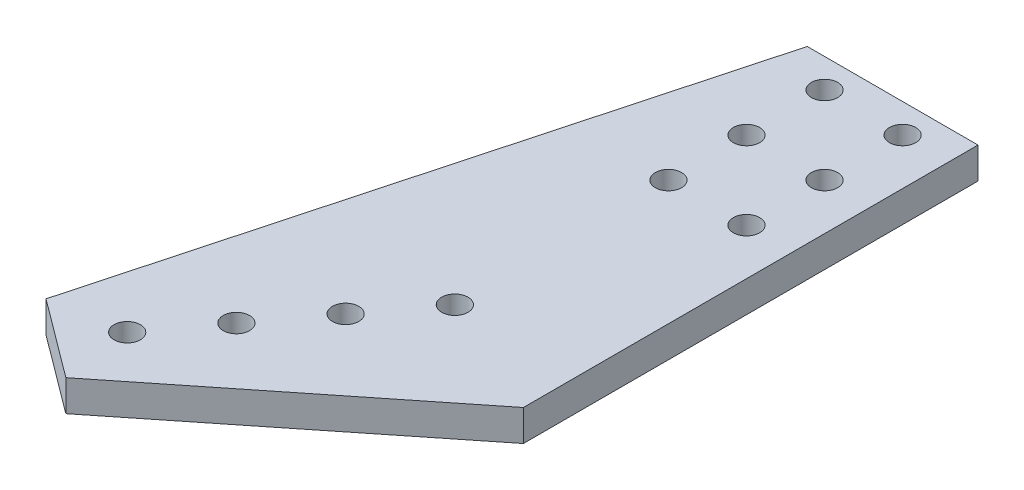
from build123d import *

# Parameters (mm, degrees)
EXTRUDE_1_DEPTH     = 32
SKETCH_2_R          = 13.5
CUT_EXTRUDE_1_DEPTH = 724.478403271


with BuildPart() as part:
    # 草图1 → 凸台-拉伸1 (new body)
    with BuildSketch(Plane(origin=(0, 0, 0), x_dir=(1, 0, 0), z_dir=(0, 1, 0))):
        Polygon((-80.153631821, 59.794609338), (86, 674), (261, 674), (261, 208), (0, 0), align=None)
    extrude(amount=EXTRUDE_1_DEPTH)

    # 草图2 → 切除-拉伸1 (cut, through all)
    with BuildSketch(Plane(origin=(0, 32, 0), x_dir=(1, 0, 0), z_dir=(0, 1, 0))):
        with Locations(Location((133.5, 644.193304549, 0), (0, 0, 270))):
            Circle(SKETCH_2_R)
        with Locations(Location((213.5, 644.193304549, 0), (0, 0, 270))):
            Circle(SKETCH_2_R)
        with Locations(Location((133.5, 564.193304549, 0), (0, 0, 270))):
            Circle(SKETCH_2_R)
        with Locations(Location((213.5, 564.193304549, 0), (0, 0, 270))):
            Circle(SKETCH_2_R)
        with Locations(Location((133.5, 484.193304549, 0), (0, 0, 270))):
            Circle(SKETCH_2_R)
        with Locations(Location((213.5, 484.193304549, 0), (0, 0, 270))):
            Circle(SKETCH_2_R)
        with Locations(Location((134.63350393, 264.093443866, 0), (0, 0, 270))):
            Circle(SKETCH_2_R)
        with Locations(Location((-8.873558482, 71.724727496, 0), (0, 0, 270))):
            Circle(SKETCH_2_R)
        with Locations(Location((86.797816459, 199.970538409, 0), (0, 0, 270))):
            Circle(SKETCH_2_R)
        with Locations(Location((38.962128989, 135.847632952, 0), (0, 0, 270))):
            Circle(SKETCH_2_R)
    extrude(amount=-CUT_EXTRUDE_1_DEPTH, mode=Mode.SUBTRACT)


solid = part.part
